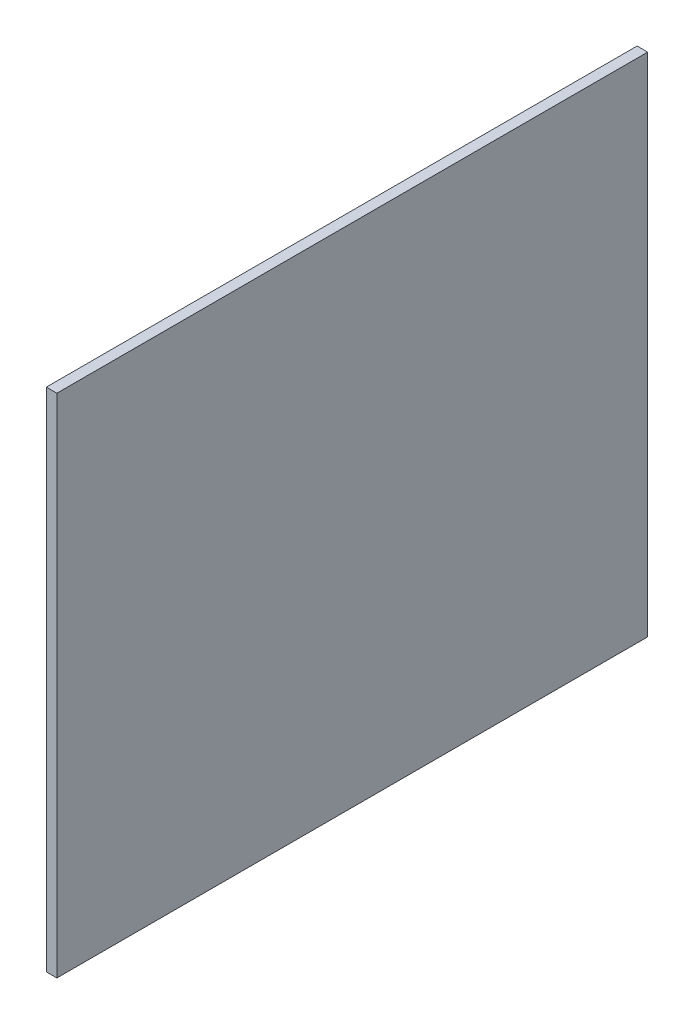
from build123d import *

# Parameters (mm, degrees)
SKETCH1_W           = 12.7
SKETCH1_H           = 711.2
BOSS_EXTRUDE1_DEPTH = 609.6


with BuildPart() as part:
    # Sketch1 → Boss-Extrude1 (new body)
    with BuildSketch(Plane(origin=(0, 0, 0), x_dir=(1, 0, 0), z_dir=(0, 1, 0))):
        with Locations((-6.35, -355.6)):
            Rectangle(SKETCH1_W, SKETCH1_H)
    extrude(amount=-BOSS_EXTRUDE1_DEPTH)


solid = part.part
